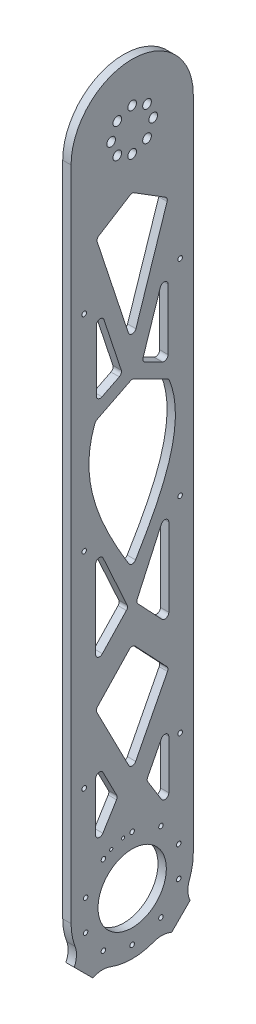
from build123d import *

# Parameters (mm, degrees)
SKETCH1_R                            = 3.3
SKETCH1_R_2                          = 1.7
SKETCH1_R_3                          = 26
BOSS_EXTRUDE1_DEPTH                  = 6.35
CUT_EXTRUDE1_DEPTH                   = 549.511460682
FILLET1_R                            = 3
SKETCH4_R                            = 1.75
CUT_EXTRUDE2_DEPTH                   = 549.511460792
SKETCH5_R                            = 1.2
CUT_EXTRUDE4_DEPTH                   = 549.511460792
BOSS_EXTRUDE2_START                  = -6.35
BOSS_EXTRUDE2_DEPTH                  = 6.35
TAP_DRILL_FOR_M3X0_5_TAP1_AT_2_COUNT = 2
TAP_DRILL_FOR_M3X0_5_TAP1_AT_2_PITCH = 13.03070812
CIRPATTERN1_COUNT                    = 2
CIRPATTERN1_ANGLE                    = 90


with BuildPart() as part:
    # Sketch1 → Boss-Extrude1 (new body)
    with BuildSketch(Plane(origin=(0, 0, 0), x_dir=(0, -1, 0), z_dir=(1, 0, 0))):
        with BuildLine():
            Line((0, 46.5), (500, 46.5))
            ThreePointArc((500, 46.5), (546.5, 0), (500, -46.5))
            Line((500, -46.5), (0, -46.5))
            ThreePointArc((0, -46.5), (-46.5, 0), (0, 46.5))
        make_face()
        with Locations(Location((-16, 0, 0), (0, 0, 90))):
            Circle(SKETCH1_R, mode=Mode.SUBTRACT)
        with Locations(Location((-11.313708499, 11.313708499, 0), (0, 0, 90))):
            Circle(SKETCH1_R, mode=Mode.SUBTRACT)
        with Locations(Location((0, 16, 0), (0, 0, 90))):
            Circle(SKETCH1_R, mode=Mode.SUBTRACT)
        with Locations(Location((11.313708499, 11.313708499, 0), (0, 0, 90))):
            Circle(SKETCH1_R, mode=Mode.SUBTRACT)
        with Locations(Location((16, 0, 0), (0, 0, 90))):
            Circle(SKETCH1_R, mode=Mode.SUBTRACT)
        with Locations(Location((11.313708499, -11.313708499, 0), (0, 0, 90))):
            Circle(SKETCH1_R, mode=Mode.SUBTRACT)
        with Locations(Location((537.25, 0, 0), (0, 0, 90))):
            Circle(SKETCH1_R_2, mode=Mode.SUBTRACT)
        with Locations(Location((530.13588304, -21.895000648, 0), (0, 0, 90))):
            Circle(SKETCH1_R_2, mode=Mode.SUBTRACT)
        with Locations(Location((511.51088304, -35.426855232, 0), (0, 0, 90))):
            Circle(SKETCH1_R_2, mode=Mode.SUBTRACT)
        with Locations(Location((488.48911696, -35.426855232, 0), (0, 0, 90))):
            Circle(SKETCH1_R_2, mode=Mode.SUBTRACT)
        with Locations(Location((469.86411696, -21.895000648, 0), (0, 0, 90))):
            Circle(SKETCH1_R_2, mode=Mode.SUBTRACT)
        with Locations(Location((462.75, 0, 0), (0, 0, 90))):
            Circle(SKETCH1_R_2, mode=Mode.SUBTRACT)
        with Locations(Location((469.86411696, 21.895000648, 0), (0, 0, 90))):
            Circle(SKETCH1_R_2, mode=Mode.SUBTRACT)
        with Locations(Location((488.48911696, 35.426855232, 0), (0, 0, 90))):
            Circle(SKETCH1_R_2, mode=Mode.SUBTRACT)
        with Locations(Location((511.51088304, 35.426855232, 0), (0, 0, 90))):
            Circle(SKETCH1_R_2, mode=Mode.SUBTRACT)
        with Locations(Location((530.13588304, 21.895000648, 0), (0, 0, 90))):
            Circle(SKETCH1_R_2, mode=Mode.SUBTRACT)
        with Locations(Location((500, 0, 0), (0, 0, 90))):
            Circle(SKETCH1_R_3, mode=Mode.SUBTRACT)
        with Locations(Location((0, -16, 0), (0, 0, 90))):
            Circle(SKETCH1_R, mode=Mode.SUBTRACT)
        with Locations(Location((-11.313708499, -11.313708499, 0), (0, 0, 90))):
            Circle(SKETCH1_R, mode=Mode.SUBTRACT)
    extrude(amount=BOSS_EXTRUDE1_DEPTH)

    # Sketch3 → Cut-Extrude1 (cut, through all)
    with BuildSketch(Plane(origin=(6.35, 0, 0), x_dir=(0, 0, -1), z_dir=(1, 0, 0))):
        Polygon((0, -422.848022722), (27.858212922, -368.632839363), (0, -339.139268075), (-27.858212922, -368.632839363), align=None)
        Polygon((0, -41.368651369), (-27.312924288, -58.435222232), (0, -141.248998295), (27.312924288, -58.435222232), align=None)
        Polygon((3, -313.189087212), (27.858212922, -339.506549748), (27.858212922, -258.646044282), align=None)
        Polygon((-27.858212922, -339.506549748), (-27.858212922, -258.646044282), (-3, -313.189087212), align=None)
        Polygon((-27.858212922, -401.452857349), (-11, -434.260816252), (-27.858212922, -461.481824785), align=None)
        Polygon((11, -434.260816252), (27.858212922, -461.481824785), (27.858212922, -401.452857349), align=None)
        with BuildLine():
            Line((0, -164.248853344), (-27.858212922, -178.200474573))
            add(Edge.make_bspline(
                [(-27.858212922, -178.200474573), (-43.7790539, -216.093343216), (-18.61661693, -258.276071598), (0, -289.085024731)],
                knots=[0, 0, 0, 0, 1, 1, 1, 1], degree=3))
            add(Edge.make_bspline(
                [(27.858212922, -178.200474573), (43.7790539, -216.093343216), (18.61661693, -258.276071598), (0, -289.085024731)],
                knots=[0, 0, 0, 0, 1, 1, 1, 1], degree=3))
            Line((27.858212922, -178.200474573), (0, -164.248853344))
        make_face()
        Polygon((7.5, -156.820958214), (27.312924288, -96.747453897), (27.312924288, -166.743432993), align=None)
        Polygon((-27.312924288, -96.747453897), (-27.312924288, -166.743432993), (-7.5, -156.820958214), align=None)
    extrude(amount=-CUT_EXTRUDE1_DEPTH, mode=Mode.SUBTRACT)

    # Fillet1
    fillet1_edges = [part.edges().sort_by_distance(p)[0] for p in [
        (3.175, -58.435222232, -27.312924288),
        (3.175, -41.368651369, 0),
        (3.175, -58.435222232, 27.312924288),
        (3.175, -141.248998295, 0),
        (3.175, -289.085024731, 0),
        (3.175, -164.248853344, 0),
        (3.175, -401.452857349, 27.858212922),
        (3.175, -434.260816252, 11),
        (3.175, -461.481824785, 27.858212922),
        (3.175, -461.481824785, -27.858212922),
        (3.175, -434.260816252, -11),
        (3.175, -401.452857349, -27.858212922),
        (3.175, -368.632839363, -27.858212922),
        (3.175, -339.139268075, 0),
        (3.175, -368.632839363, 27.858212922),
        (3.175, -422.848022722, 0),
        (3.175, -313.189087212, 3),
        (3.175, -339.506549748, 27.858212922),
        (3.175, -258.646044282, 27.858212922),
        (3.175, -178.200474573, -27.858212922),
        (3.175, -178.200474573, 27.858212922),
        (3.175, -339.506549748, -27.858212922),
        (3.175, -313.189087212, -3),
        (3.175, -258.646044282, -27.858212922),
        (3.175, -96.747453897, 27.312924288),
        (3.175, -166.743432993, 27.312924288),
        (3.175, -156.820958214, 7.5),
        (3.175, -166.743432993, -27.312924288),
        (3.175, -156.820958214, -7.5),
        (3.175, -96.747453897, -27.312924288),
    ]]
    fillet(fillet1_edges, radius=FILLET1_R)

    # Sketch4 → Cut-Extrude2 (cut, through all)
    with BuildSketch(Plane(origin=(6.35, 0, 0), x_dir=(0, 0, -1), z_dir=(1, 0, 0))):
        with Locations((-36.5, -103.175)):
            Circle(SKETCH4_R)
        with Locations(Location((36.5, -103.175, 0), (0, 0, 180))):
            Circle(SKETCH4_R)
        with Locations(Location((-36.5, -259.525, 0), (0, 0, 180))):
            Circle(SKETCH4_R)
        with Locations((36.5, -259.525)):
            Circle(SKETCH4_R)
        with Locations((-36.5, -415.875)):
            Circle(SKETCH4_R)
        with Locations(Location((36.5, -415.875, 0), (0, 0, 180))):
            Circle(SKETCH4_R)
    extrude(amount=-CUT_EXTRUDE2_DEPTH, mode=Mode.SUBTRACT)

    # Sketch5 → Cut-Extrude4 (cut, through all)
    with BuildSketch(Plane(origin=(6.35, 0, 0), x_dir=(0, 0, -1), z_dir=(1, 0, 0))):
        with Locations((-6.916110339, -463.343078174)):
            Circle(SKETCH5_R)
        with Locations((-15.951147244, -466.27873962)):
            Circle(SKETCH5_R)
    extrude(amount=-CUT_EXTRUDE4_DEPTH, mode=Mode.SUBTRACT)

    # Sketch6 → Boss-Extrude2 (add)
    with BuildSketch(Plane(origin=(6.35, 0, 0), x_dir=(0, 0, -1), z_dir=(1, 0, 0)).offset(BOSS_EXTRUDE2_START)):
        with BuildLine():
            Line((-44.110383395, -529.968247771), (-29.968247771, -544.110383395))
            ThreePointArc((-29.968247771, -544.110383395), (-23.286397782, -542.399293624), (-16.474718596, -543.483717035))
            ThreePointArc((-16.474718596, -543.483717035), (-32.880465325, -532.880465325), (-43.483717035, -516.474718596))
            ThreePointArc((-43.483717035, -516.474718596), (-42.399293624, -523.286397782), (-44.110383395, -529.968247771))
        make_face()
    boss_extrude2 = extrude(amount=BOSS_EXTRUDE2_DEPTH)

    # Sketch8 → Tap Drill for M3x0.5 Tap1 (revolve, cut)
    with BuildSketch(Plane(origin=(3.175, -532.796674896, 41.28195627), x_dir=(0, -0.7071067811865424, -0.7071067811865527), z_dir=(1, 0, 0))):
        Polygon((0, 0), (0, 5.751075774), (1.25, 5), (1.25, 0), align=None)
    tap_drill_for_m3x0_5_tap1 = revolve(axis=Axis((3.175, -537.286802956, 45.772084331), (0, 0.7071067811865529, -0.7071067811865422)), mode=Mode.SUBTRACT)

    # Tap Drill for M3x0.5 Tap1 at 2: Tap Drill for M3x0.5 Tap1 ×2
    with Locations(*[Vector(0, -0.7071067811865422, -0.7071067811865529) * (i * TAP_DRILL_FOR_M3X0_5_TAP1_AT_2_PITCH) for i in range(1, TAP_DRILL_FOR_M3X0_5_TAP1_AT_2_COUNT)]):
        add(tap_drill_for_m3x0_5_tap1, mode=Mode.SUBTRACT)

    # CirPattern1: Boss-Extrude2, Tap Drill for M3x0.5 Tap1 ×2 about axis
    cirpattern1_axis = Axis((0, -500, 0), (1, 0, 0))
    add([boss_extrude2.rotate(cirpattern1_axis, i * CIRPATTERN1_ANGLE / (CIRPATTERN1_COUNT - 1)) for i in range(1, CIRPATTERN1_COUNT)])
    add([tap_drill_for_m3x0_5_tap1.rotate(cirpattern1_axis, i * CIRPATTERN1_ANGLE / (CIRPATTERN1_COUNT - 1)) for i in range(1, CIRPATTERN1_COUNT)], mode=Mode.SUBTRACT)

    # CirPattern1 copy 1 sketch → CirPattern1 copy 1 (revolve, cut)
    with BuildSketch(Plane(origin=(3.175, -532.067854195, -42.010776971), x_dir=(0, 0.7071067811865551, -0.7071067811865399), z_dir=(1, 0, 0))):
        Polygon((0, 0), (0, 5.751075774), (1.25, 5), (1.25, 0), align=None)
    revolve(axis=Axis((3.175, -536.557982255, -46.500905032), (0, 0.7071067811865398, 0.7071067811865553)), mode=Mode.SUBTRACT)


solid = part.part
